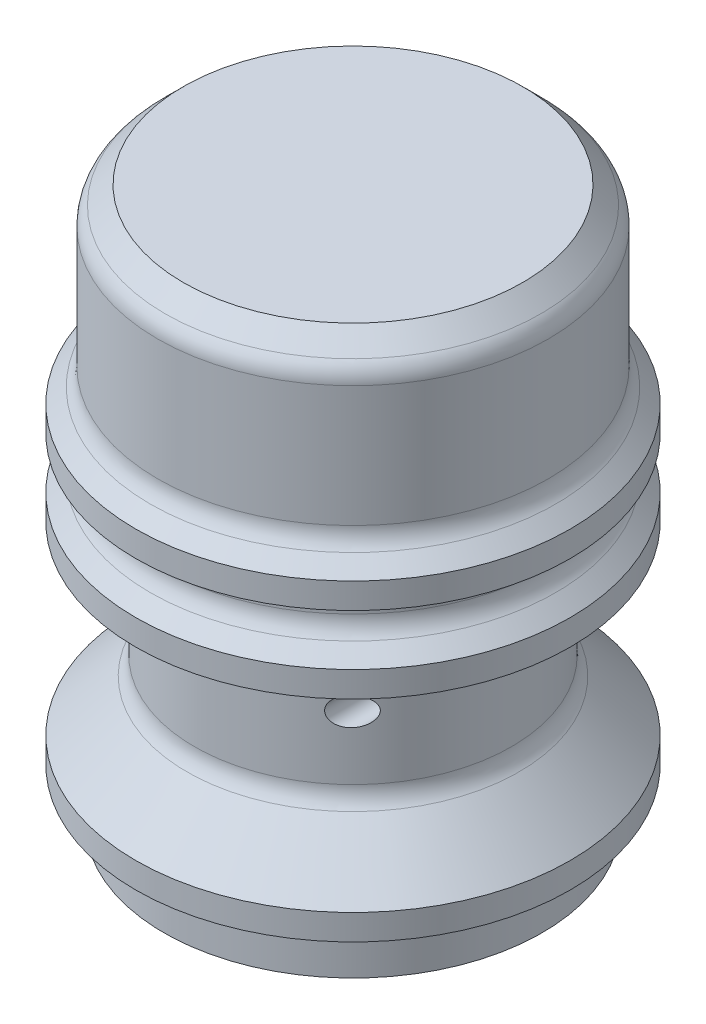
from build123d import *

# Parameters (mm, degrees)
CORTE_EXTRUS_O1_REACH      = 30.96
CORTE_EXTRUS_O1_END_RADIUS = 4.889
ESBO_O9_R                  = 0.546
PADR_OCIRCULAR2_COUNT      = 4
CHANFRO1_SIZE              = 1
FILETE3_R                  = 1
FILETE_TOPO_R              = 0.35
FILETE_BASE_R              = 2
FILETE4_R                  = 1
FILETE5_R                  = 0.5


with BuildPart() as part:
    # Esboço4 → Revolução1 (revolve)
    with BuildSketch(Plane.XY, mode=Mode.PRIVATE) as revolu_o1_sk:
        Polygon((3.105, 1), (3.105, 10.329), (5.46, 12.684), (5.46, 19.658), (0, 19.658), (0, 21.658), (7.641447786, 21.658), (7.641447786, 10.732), (6.204569846, 10.732), (6.204569846, 4), (7.4, 4), (7.4, 0), (5.798, 0), (5.798, 2.899), (4.889, 4.473434184), (4.889, 4.889), (4.889, 9.232), (4.105, 9.232), (4.105, 1), align=None)
    revolve(revolu_o1_sk.sketch.rotate(Axis((0, 0, 0), (0, 1, 0)), 90), axis=Axis((0, 0, 0), (0, 1, 0)))

    # Corte-extrusão1: up to this cylinder (the profile starts outside it)
    corte_extrus_o1_end = Plane(origin=(0, 8.186, 0), z_dir=(0, -1, 0)) * Cylinder(CORTE_EXTRUS_O1_END_RADIUS, 72.698, mode=Mode.PRIVATE)
    # Esboço9 → Corte-extrusão1 (cut, up to the surface)
    with BuildSketch(Plane.XY.offset(-10), mode=Mode.PRIVATE) as corte_extrus_o1_sk1:
        with Locations(Location((-4.343, 8.186, 0), (0, 0, 180))):
            Circle(ESBO_O9_R)
    corte_extrus_o1_tool1 = extrude(corte_extrus_o1_sk1.sketch, amount=CORTE_EXTRUS_O1_REACH, mode=Mode.PRIVATE) - corte_extrus_o1_end
    corte_extrus_o1 = corte_extrus_o1_tool1.solids().sort_by_distance((-4.343, 8.186, -10))[0]
    add(corte_extrus_o1, mode=Mode.SUBTRACT)

    # PadrãoCircular2: Corte-extrusão1 ×4 about axis
    padr_ocircular2_axis = Axis((0, 0, 0), (0, 1, 0))
    for i in range(1, PADR_OCIRCULAR2_COUNT):
        add(corte_extrus_o1.rotate(padr_ocircular2_axis, i * 360 / PADR_OCIRCULAR2_COUNT), mode=Mode.SUBTRACT)

    # Chanfro1
    chanfro1_edges = [part.edges().sort_by_distance(p)[0] for p in [
        (0, 21.658, 7.641447786),
    ]]
    chamfer(chanfro1_edges, length=CHANFRO1_SIZE)

    # Filete3
    filete3_edges = [part.edges().sort_by_distance(p)[0] for p in [
        (0, 20.658, 7.641447786),
    ]]
    fillet(filete3_edges, radius=FILETE3_R)

    # Filete_topo
    filete_topo_edges = [part.edges().sort_by_distance(p)[0] for p in [
        (0, 9.232, 4.105),
        (0, 9.232, 4.889),
        (0, 19.658, 5.46),
    ]]
    fillet(filete_topo_edges, radius=FILETE_TOPO_R)

    # Filete_base
    filete_base_edges = [part.edges().sort_by_distance(p)[0] for p in [
        (0, 4.473434184, 4.889),
        (0, 2.899, 5.798),
        (0, 12.684, 5.46),
        (0, 10.329, 3.105),
    ]]
    fillet(filete_base_edges, radius=FILETE_BASE_R)

    # Esboço11 → Revolução2 (revolve)
    with BuildSketch(Plane.XY, mode=Mode.PRIVATE) as revolu_o2_sk:
        Polygon((6.204569846, 10.232), (8.5, 10.232), (8.5, 11.232), (7.641447786, 12.090552214), (7.641447786, 13.232), (8.5, 13.232), (8.5, 14.232), (7.641447786, 15.090552214), (7.141447786, 15.090552214), (7.141447786, 11.232), (5.704569846, 11.232), (5.704569846, 10.232), align=None)
        Polygon((7.4, 2), (8.5, 2), (8.5, 3), (6.204569846, 5.295430154), (5.704569846, 5.295430154), (5.704569846, 4), (6.9, 2), align=None)
    revolve(revolu_o2_sk.sketch.rotate(Axis((0, 0, 0), (0, 1, 0)), 90), axis=Axis((0, 0, 0), (0, 1, 0)))

    # Filete4
    filete4_edges = [part.edges().sort_by_distance(p)[0] for p in [
        (0, 5.295430154, 6.204569846),
        (0, 15.090552214, 7.641447786),
        (0, 12.090552214, 7.641447786),
        (0, 10.232, 6.204569846),
    ]]
    fillet(filete4_edges, radius=FILETE4_R)

    # Filete5
    filete5_edges = [part.edges().sort_by_distance(p)[0] for p in [
        (0, 2, 7.4),
        (0, 13.232, 7.641447786),
    ]]
    fillet(filete5_edges, radius=FILETE5_R)

    # Esboço12 → Revolução3 (revolve)
    with BuildSketch(Plane.XY, mode=Mode.PRIVATE) as revolu_o3_sk:
        Polygon((-3.755907377, 1), (-3.755907377, 10.085784813), (-6.693701371, 13.543615987), (-6.693701371, 20.463139806), (0, 20.463139806), (0, 1), align=None)
    revolve(revolu_o3_sk.sketch.rotate(Axis((0, 0, 0), (0, -1, 0)), 90), axis=Axis((0, 0, 0), (0, -1, 0)))


solid = part.part
